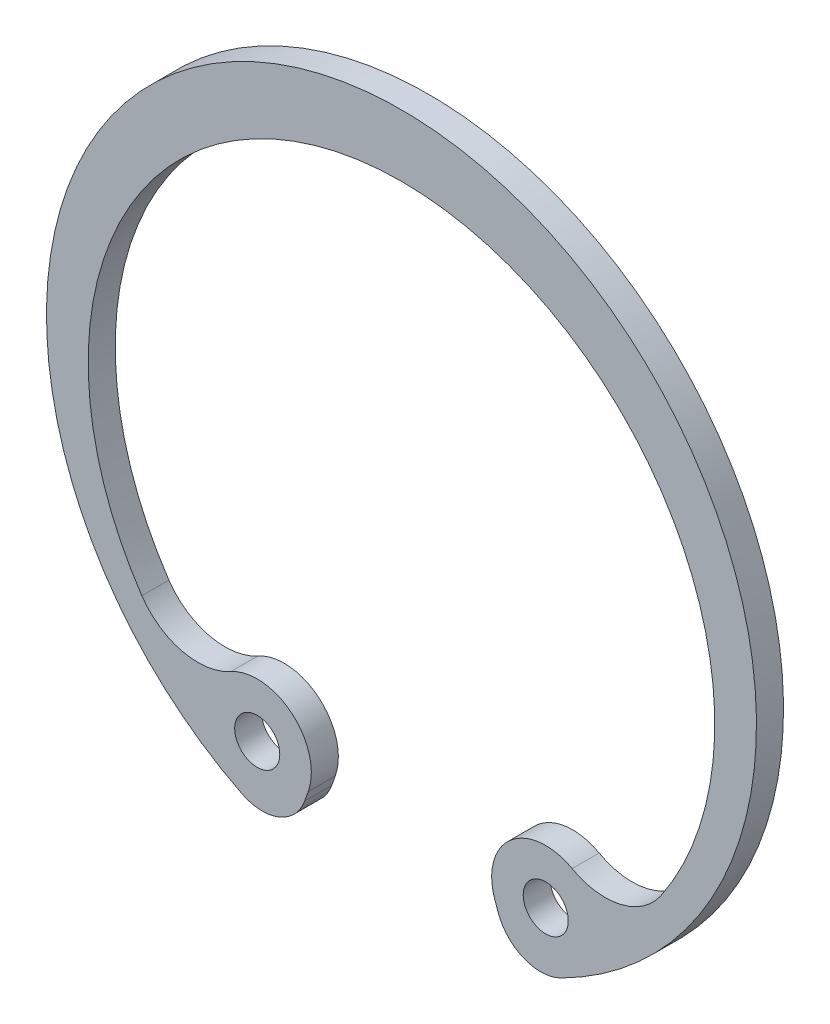
from build123d import *

# Parameters (mm, degrees)
SKETCH1_R  = 1
BODY_DEPTH = 1.2


with BuildPart() as part:
    # Sketch1 → Body (new body)
    with BuildSketch(Plane.XY):
        with BuildLine():
            Line((4.139124405, -11.62116667), (4.293680087, -12.055103216))
            ThreePointArc((4.293680087, -12.055103216), (5.433429283, -13.240393983), (7.076323895, -13.170825851))
            ThreePointArc((7.076323895, -13.170825851), (0, 16.65), (-7.076323895, -13.170825851))
            ThreePointArc((-7.076323895, -13.170825851), (-5.433429283, -13.240393983), (-4.293680087, -12.055103216))
            Line((-4.293680087, -12.055103216), (-4.139124405, -11.62116667))
            ThreePointArc((-4.139124405, -11.62116667), (-4.850462528, -8.983168612), (-7.570021573, -8.720424866))
            ThreePointArc((-7.570021573, -8.720424866), (-9.727430565, -9.019484739), (-11.518571073, -7.780264805))
            ThreePointArc((-11.518571073, -7.780264805), (0, 13.9), (11.518571073, -7.780264805))
            ThreePointArc((11.518571073, -7.780264805), (9.727430565, -9.019484739), (7.570021573, -8.720424866))
            ThreePointArc((7.570021573, -8.720424866), (4.850462528, -8.983168612), (4.139124405, -11.62116667))
        make_face()
        with Locations((-6.4, -10.815907989)):
            Circle(SKETCH1_R, mode=Mode.SUBTRACT)
        with Locations(Location((6.4, -10.815907989, 0), (0, 0, 180))):
            Circle(SKETCH1_R, mode=Mode.SUBTRACT)
    extrude(amount=BODY_DEPTH)


solid = part.part
